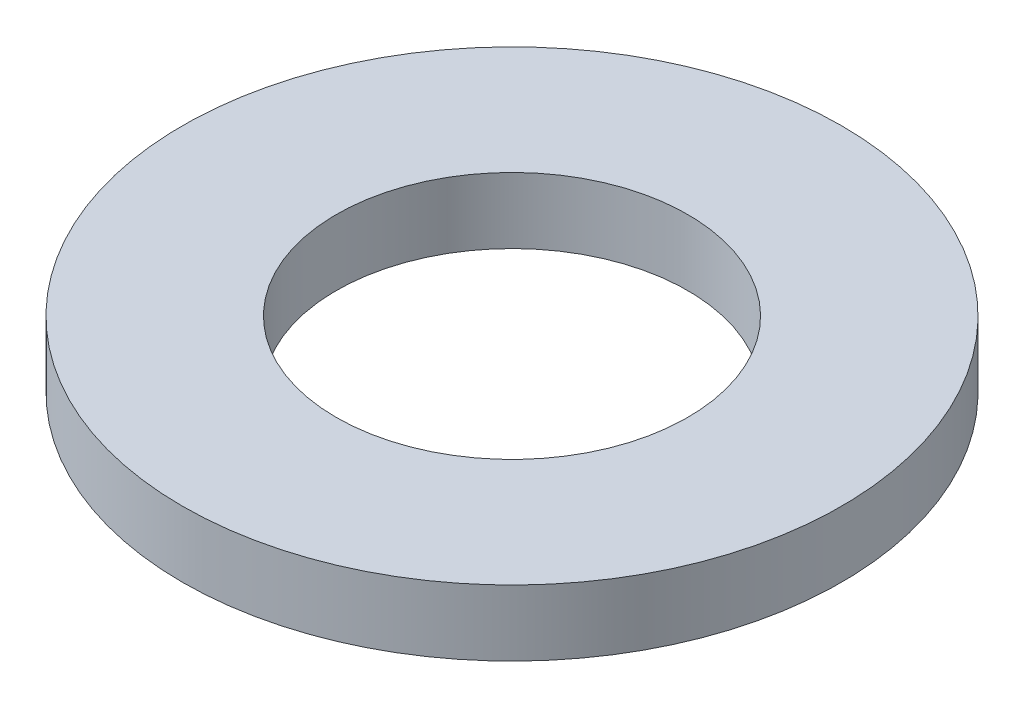
from build123d import *

# Parameters (mm, degrees)
SKETCH_1_R      = 7.5
SKETCH_1_R_2    = 4
EXTRUDE_1_DEPTH = 1.5


with BuildPart() as part:
    # 草图1 → 凸台-拉伸1 (new body)
    with BuildSketch(Plane(origin=(0, 0, 0), x_dir=(1, 0, 0), z_dir=(0, 1, 0))):
        with Locations(Location((0, 0, 0), (0, 0, 270))):
            Circle(SKETCH_1_R)
        with Locations(Location((0, 0, 0), (0, 0, 270))):
            Circle(SKETCH_1_R_2, mode=Mode.SUBTRACT)
    extrude(amount=EXTRUDE_1_DEPTH)


solid = part.part
